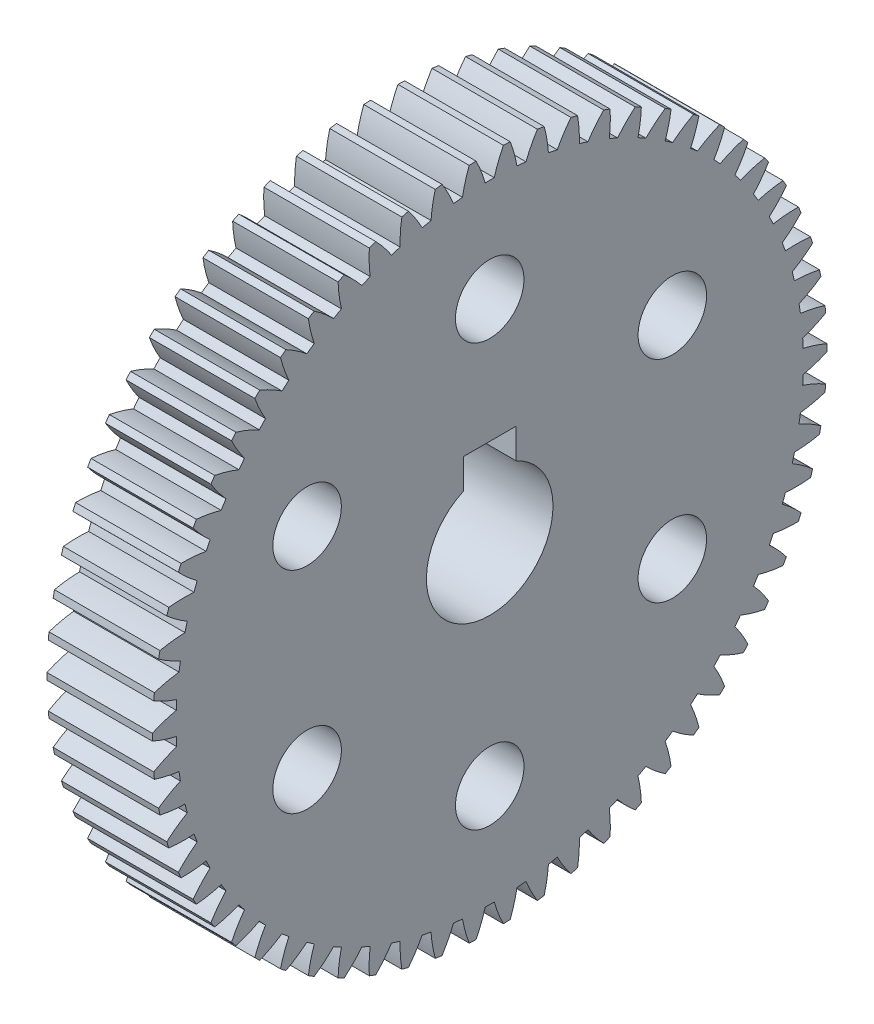
from build123d import *

# Parameters (mm, degrees)
BASPROSKE_W        = 10
BASPROSKE_H        = 32
TOOTHCUT_DEPTH     = 47.346520905
TEETHCUTS_COUNT    = 62
TEETHCUTS_ANGLE    = 354.193548387
BORSKE_R           = 6
BORE_DEPTH         = 50.0000508
KEYSKE_W           = 5
KEYSKE_H           = 8.3
KEYWAY_DEPTH       = 50.0000508
SKETCH1_R          = 3.25
CUT_EXTRUDE1_DEPTH = 47.328359105
CIRPATTERN1_COUNT  = 6


with BuildPart() as part:
    # BasProSke → Base-Revolve (revolve)
    with BuildSketch(Plane(origin=(0, 0, 0), x_dir=(1, 0, 0), z_dir=(0, 1, 0)), mode=Mode.PRIVATE) as base_revolve_sk:
        with Locations((5, 16)):
            Rectangle(BASPROSKE_W, BASPROSKE_H)
    revolve(base_revolve_sk.sketch.rotate(Axis((-10, 0, 0), (1, 0, 0)), 180), axis=Axis((-10, 0, 0), (1, 0, 0)))

    # TooCutSke → ToothCut (cut, through all)
    with BuildSketch(Plane(origin=(0, 0, 0), x_dir=(0, 0, -1), z_dir=(1, 0, 0))):
        with BuildLine():
            ThreePointArc((0.428926933, 29.745907663), (0, 29.749), (-0.428926933, 29.745907663))
            ThreePointArc((-0.428926933, 29.745907663), (-0.814399528, 30.893786924), (-1.30999226, 31.998596304))
            ThreePointArc((-1.30999226, 31.998596304), (0, 32.0254), (1.30999226, 31.998596304))
            ThreePointArc((1.30999226, 31.998596304), (0.814399528, 30.893786924), (0.428926933, 29.745907663))
        make_face()
    toothcut = extrude(amount=TOOTHCUT_DEPTH, mode=Mode.SUBTRACT)

    # TeethCuts: ToothCut ×62 about axis
    teethcuts_axis = Axis((-10, 0, 0), (1, 0, 0))
    for i in range(1, TEETHCUTS_COUNT):
        add(toothcut.rotate(teethcuts_axis, i * TEETHCUTS_ANGLE / (TEETHCUTS_COUNT - 1)), mode=Mode.SUBTRACT)

    # BorSke → Bore (cut, symmetric)
    with BuildSketch(Plane(origin=(0, 0, 0), x_dir=(0, 0, -1), z_dir=(1, 0, 0))):
        with Locations(Location((0, 0, 0), (0, 0, 180))):
            Circle(BORSKE_R)
    extrude(amount=BORE_DEPTH, both=True, mode=Mode.SUBTRACT)

    # KeySke → Keyway (cut, symmetric)
    with BuildSketch(Plane(origin=(0, 0, 0), x_dir=(0, 0, -1), z_dir=(1, 0, 0))):
        with Locations((0, 4.15)):
            Rectangle(KEYSKE_W, KEYSKE_H)
    extrude(amount=KEYWAY_DEPTH, both=True, mode=Mode.SUBTRACT)

    # Sketch1 → Cut-Extrude1 (cut, through all)
    with BuildSketch(Plane.ZY):
        with Locations((0, 20)):
            Circle(SKETCH1_R)
    cut_extrude1 = extrude(amount=-CUT_EXTRUDE1_DEPTH, mode=Mode.SUBTRACT)

    # CirPattern1: Cut-Extrude1 ×6 about axis
    cirpattern1_axis = Axis((0, 0, 0), (1, 0, 0))
    for i in range(1, CIRPATTERN1_COUNT):
        add(cut_extrude1.rotate(cirpattern1_axis, i * 360 / CIRPATTERN1_COUNT), mode=Mode.SUBTRACT)


solid = part.part
